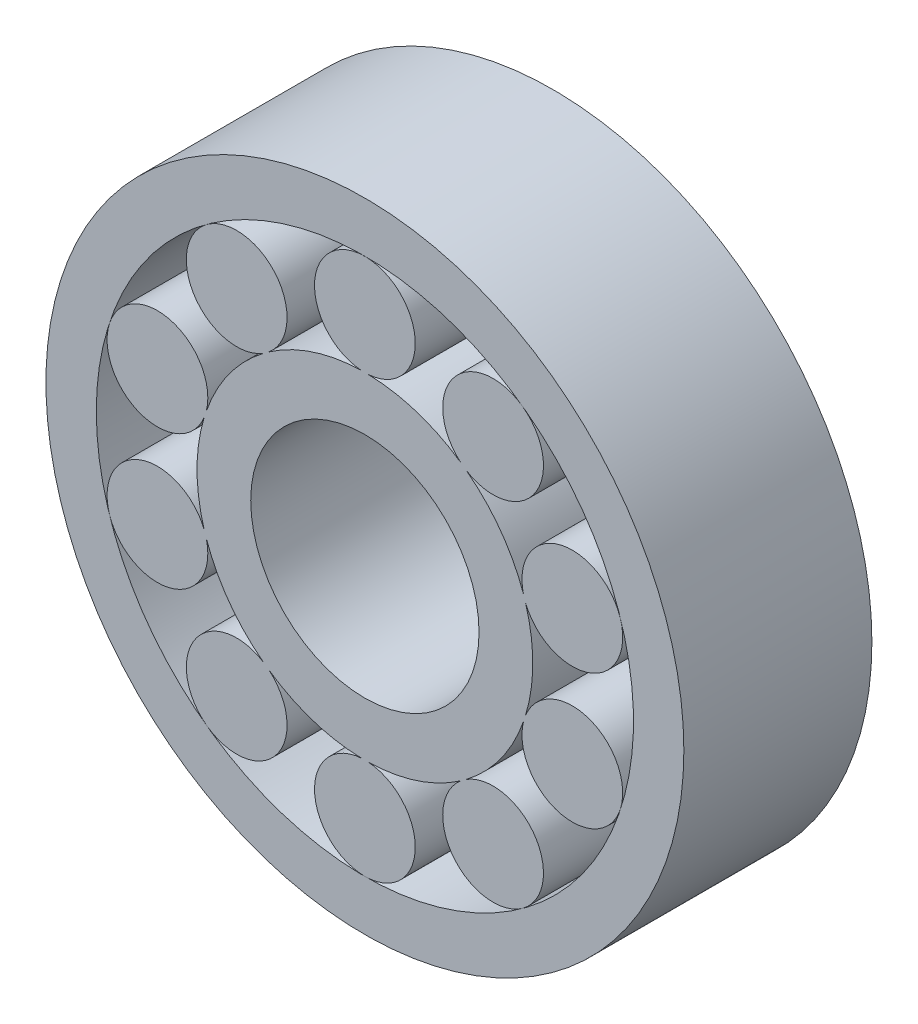
from build123d import *

# Parameters (mm, degrees)
CROQUIS1_R              = 23.75
CROQUIS1_R_2            = 8.5
SALIENTE_EXTRUIR1_DEPTH = 14
CROQUIS2_R              = 20
CROQUIS2_R_2            = 12.5
CORTAR_EXTRUIR1_DEPTH   = 14
CROQUIS3_R              = 3.75
SALIENTE_EXTRUIR2_DEPTH = 14


with BuildPart() as part:
    # Croquis1 → Saliente-Extruir1 (new body)
    with BuildSketch(Plane.XY):
        Circle(CROQUIS1_R)
        Circle(CROQUIS1_R_2, mode=Mode.SUBTRACT)
    extrude(amount=SALIENTE_EXTRUIR1_DEPTH)

    # Croquis2 → Cortar-Extruir1 (cut)
    with BuildSketch(Plane(origin=(0, 0, 0), x_dir=(-1, 0, 0), z_dir=(0, 0, -1))):
        Circle(CROQUIS2_R)
        Circle(CROQUIS2_R_2, mode=Mode.SUBTRACT)
    extrude(amount=-CORTAR_EXTRUIR1_DEPTH, mode=Mode.SUBTRACT)


with BuildPart() as cortar_extruir1_piece_1:
    # of the separate pieces the step leaves, piece 1, a body of its own (cortar_extruir1_pieces)
    add(part.part.solids().sort_by_distance((23.75, 0, 0))[0])


with BuildPart() as cortar_extruir1_piece_2:
    # of the separate pieces the step leaves, piece 2, a body of its own (cortar_extruir1_pieces)
    add(part.part.solids().sort_by_distance((-12.5, 0, 0))[0])

    # Croquis3 → Saliente-Extruir2 (add)
    with BuildSketch(Plane(origin=(0, 0, 0), x_dir=(-1, 0, 0), z_dir=(0, 0, -1))):
        with Locations((0, 16.24)):
            Circle(CROQUIS3_R)
        with Locations((9.545632497, 13.138435989)):
            Circle(CROQUIS3_R)
        with Locations((15.445157825, 5.018435989)):
            Circle(CROQUIS3_R)
        with Locations((15.445157825, -5.018435989)):
            Circle(CROQUIS3_R)
        with Locations((9.545632497, -13.138435989)):
            Circle(CROQUIS3_R)
        with Locations((0, -16.24)):
            Circle(CROQUIS3_R)
        with Locations((-9.545632497, -13.138435989)):
            Circle(CROQUIS3_R)
        with Locations((-15.445157825, -5.018435989)):
            Circle(CROQUIS3_R)
        with Locations((-15.445157825, 5.018435989)):
            Circle(CROQUIS3_R)
        with Locations((-9.545632497, 13.138435989)):
            Circle(CROQUIS3_R)
    extrude(amount=-SALIENTE_EXTRUIR2_DEPTH)


solid = Compound([cortar_extruir1_piece_1.part, cortar_extruir1_piece_2.part])
